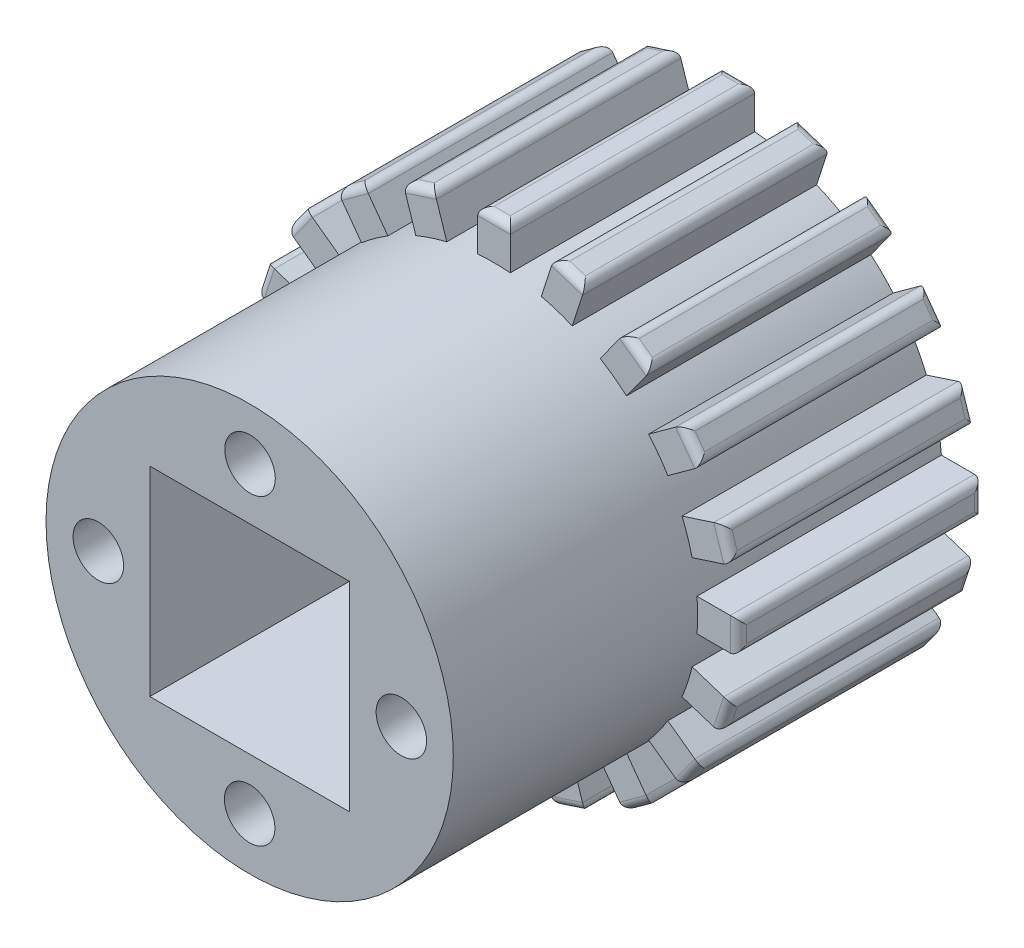
from build123d import *

# Parameters (mm, degrees)
SKETCH1_R                = 12.5
BOSS_EXTRUDE1_DEPTH      = 7.5
SKETCH4_W                = 2
SKETCH4_H                = 15
BOSS_EXTRUDE3_DEPTH      = 15
FILLET1_R                = 0.5
CIRPATTERN7_COUNT        = 20
FILLET1_OF_CIRPATTERN7_R = 0.5
BOSS_EXTRUDE4_START      = 15
SKETCH10_R               = 12.5
BOSS_EXTRUDE4_DEPTH      = 15
CUT_EXTRUDE3_START       = 15
SKETCH8_W                = 12.25
SKETCH8_H                = 12.25
CUT_EXTRUDE3_DEPTH       = 30
CUT_EXTRUDE4_START       = 15
SKETCH9_R                = 1.55
CUT_EXTRUDE4_DEPTH       = 41.980762


with BuildPart() as part:
    # Sketch1 → Boss-Extrude1 (new, symmetric)
    with BuildSketch(Plane.XY):
        Circle(SKETCH1_R)
    extrude(amount=BOSS_EXTRUDE1_DEPTH, both=True)

    # Sketch4 → Boss-Extrude3 (add)
    with BuildSketch(Plane.XY.offset(7.5)):
        with Locations((0, 7.5)):
            Rectangle(SKETCH4_W, SKETCH4_H)
    boss_extrude3 = extrude(amount=-BOSS_EXTRUDE3_DEPTH)

    # Fillet1
    fillet1_edges = [part.edges().sort_by_distance(p)[0] for p in [
        (1, 15, 0),
        (-1, 15, 0),
        (0, 15, 7.5),
        (0, 15, -7.5),
    ]]
    fillet(fillet1_edges, radius=FILLET1_R)

    # CirPattern7: Boss-Extrude3 ×20 about axis
    cirpattern7_axis = Axis((0, 0, 0), (0, 0, 1))
    for i in range(1, CIRPATTERN7_COUNT):
        add(boss_extrude3.rotate(cirpattern7_axis, i * 360 / CIRPATTERN7_COUNT))

    # Fillet1 of CirPattern7
    fillet1_of_cirpattern7_edges = [part.edges().sort_by_distance(p)[0] for p in [
        (-3.684198, 14.574865, 0),
        (-5.586311, 13.956831, 0),
        (-4.635255, 14.265848, 7.5),
        (-4.635255, 14.265848, -7.5),
        (-8.007762, 12.72304, 0),
        (-9.625796, 11.54747, 0),
        (-8.816779, 12.135255, 7.5),
        (-8.816779, 12.135255, -7.5),
        (-11.54747, 9.625796, 0),
        (-12.72304, 8.007762, 0),
        (-12.135255, 8.816779, 7.5),
        (-12.135255, 8.816779, -7.5),
        (-13.956831, 5.586311, 0),
        (-14.574865, 3.684198, 0),
        (-14.265848, 4.635255, 7.5),
        (-14.265848, 4.635255, -7.5),
        (-15, 1, 0),
        (-15, -1, 0),
        (-15, 0, 7.5),
        (-15, 0, -7.5),
        (-14.574865, -3.684198, 0),
        (-13.956831, -5.586311, 0),
        (-14.265848, -4.635255, 7.5),
        (-14.265848, -4.635255, -7.5),
        (-12.72304, -8.007762, 0),
        (-11.54747, -9.625796, 0),
        (-12.135255, -8.816779, 7.5),
        (-12.135255, -8.816779, -7.5),
        (-9.625796, -11.54747, 0),
        (-8.007762, -12.72304, 0),
        (-8.816779, -12.135255, 7.5),
        (-8.816779, -12.135255, -7.5),
        (-5.586311, -13.956831, 0),
        (-3.684198, -14.574865, 0),
        (-4.635255, -14.265848, 7.5),
        (-4.635255, -14.265848, -7.5),
        (-1, -15, 0),
        (1, -15, 0),
        (0, -15, 7.5),
        (0, -15, -7.5),
        (3.684198, -14.574865, 0),
        (5.586311, -13.956831, 0),
        (4.635255, -14.265848, 7.5),
        (4.635255, -14.265848, -7.5),
        (8.007762, -12.72304, 0),
        (9.625796, -11.54747, 0),
        (8.816779, -12.135255, 7.5),
        (8.816779, -12.135255, -7.5),
        (11.54747, -9.625796, 0),
        (12.72304, -8.007762, 0),
        (12.135255, -8.816779, 7.5),
        (12.135255, -8.816779, -7.5),
        (13.956831, -5.586311, 0),
        (14.574865, -3.684198, 0),
        (14.265848, -4.635255, 7.5),
        (14.265848, -4.635255, -7.5),
        (15, -1, 0),
        (15, 1, 0),
        (15, 0, 7.5),
        (15, 0, -7.5),
        (14.574865, 3.684198, 0),
        (13.956831, 5.586311, 0),
        (14.265848, 4.635255, 7.5),
        (14.265848, 4.635255, -7.5),
        (12.72304, 8.007762, 0),
        (11.54747, 9.625796, 0),
        (12.135255, 8.816779, 7.5),
        (12.135255, 8.816779, -7.5),
        (9.625796, 11.54747, 0),
        (8.007762, 12.72304, 0),
        (8.816779, 12.135255, 7.5),
        (8.816779, 12.135255, -7.5),
        (5.586311, 13.956831, 0),
        (3.684198, 14.574865, 0),
        (4.635255, 14.265848, 7.5),
        (4.635255, 14.265848, -7.5),
    ]]
    fillet(fillet1_of_cirpattern7_edges, radius=FILLET1_OF_CIRPATTERN7_R)

    # Sketch10 → Boss-Extrude4 (add)
    with BuildSketch(Plane.XY.offset(7.5).offset(BOSS_EXTRUDE4_START)):
        with Locations(Location((0, 0, 0), (0, 0, 175.411434))):
            Circle(SKETCH10_R)
    extrude(amount=-BOSS_EXTRUDE4_DEPTH)

    # Sketch8 → Cut-Extrude3 (cut)
    with BuildSketch(Plane.XY.offset(7.5).offset(CUT_EXTRUDE3_START)):
        Rectangle(SKETCH8_W, SKETCH8_H)
    extrude(amount=-CUT_EXTRUDE3_DEPTH, mode=Mode.SUBTRACT)

    # Sketch9 → Cut-Extrude4 (cut, through all)
    with BuildSketch(Plane.XY.offset(7.5).offset(CUT_EXTRUDE4_START)):
        with Locations((9.3125, 0)):
            Circle(SKETCH9_R)
        with Locations((0, -9.2875)):
            Circle(SKETCH9_R)
        with Locations((-9.2875, 0.025)):
            Circle(SKETCH9_R)
        with Locations((0.025, 9.3125)):
            Circle(SKETCH9_R)
    extrude(amount=-CUT_EXTRUDE4_DEPTH, mode=Mode.SUBTRACT)


solid = part.part
